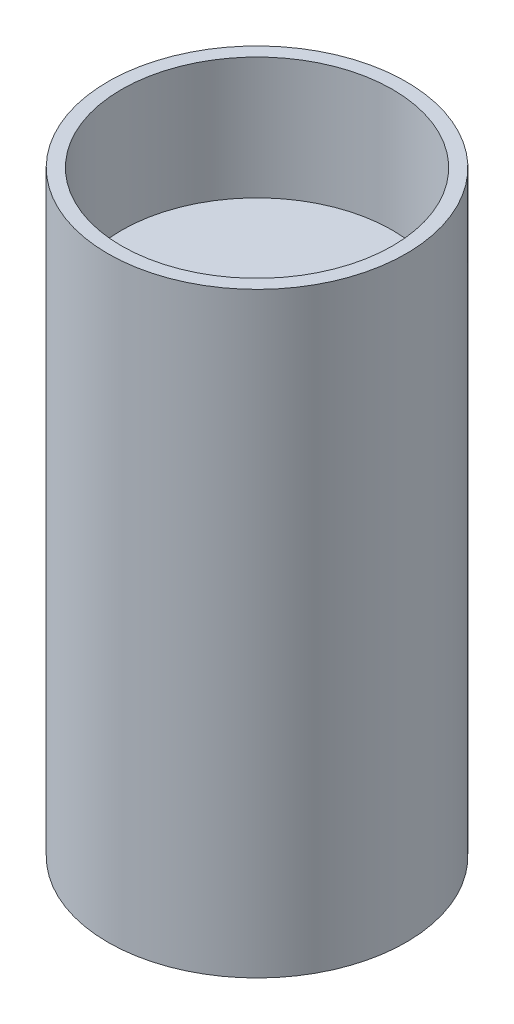
from build123d import *

# Parameters (mm, degrees)
CROQUIS1_R              = 55
SALIENTE_EXTRUIR1_DEPTH = 220
CROQUIS2_R              = 46.986579917
CORTAR_EXTRUIR1_DEPTH   = 150
CROQUIS3_R              = 50
CORTAR_EXTRUIR2_DEPTH   = 45


with BuildPart() as part:
    # Croquis1 → Saliente-Extruir1 (new body)
    with BuildSketch(Plane(origin=(0, 0, 0), x_dir=(1, 0, 0), z_dir=(0, 1, 0))):
        with Locations(Location((0, 0, 0), (0, 0, 270))):
            Circle(CROQUIS1_R)
    extrude(amount=SALIENTE_EXTRUIR1_DEPTH)

    # Croquis2 → Cortar-Extruir1 (cut)
    with BuildSketch(Plane.XZ):
        with Locations(Location((0, 0, 0), (0, 0, 270))):
            Circle(CROQUIS2_R)
    extrude(amount=-CORTAR_EXTRUIR1_DEPTH, mode=Mode.SUBTRACT)

    # Croquis3 → Cortar-Extruir2 (cut)
    with BuildSketch(Plane(origin=(0, 220, 0), x_dir=(1, 0, 0), z_dir=(0, 1, 0))):
        with Locations(Location((0, 0, 0), (0, 0, 270))):
            Circle(CROQUIS3_R)
    extrude(amount=-CORTAR_EXTRUIR2_DEPTH, mode=Mode.SUBTRACT)


solid = part.part
